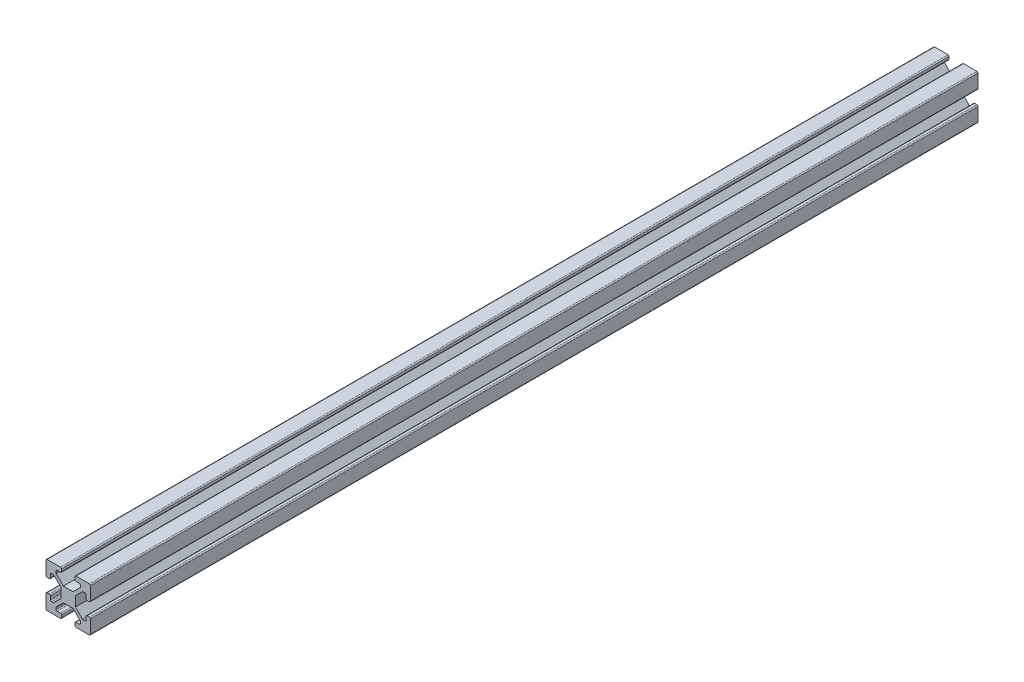
from build123d import *

# Parameters (mm, degrees)
EXTRUDE_1_DEPTH = 400


with BuildPart() as part:
    # 草图1 → 凸台-拉伸1 (new body)
    with BuildSketch(Plane.XY):
        with BuildLine():
            Line((6.5, 0), (0.5, 0))
            ThreePointArc((0.5, 0), (0.146446609, -0.146446609), (0, -0.5))
            Line((0, -0.5), (0, -6.5))
            ThreePointArc((0, -6.5), (0.146446609, -6.853553391), (0.5, -7))
            Line((0.5, -7), (1.5, -7))
            ThreePointArc((1.5, -7), (1.853553391, -6.853553391), (2, -6.5))
            Line((2, -6.5), (2, -5))
            ThreePointArc((2, -5), (2.146446609, -4.646446609), (2.5, -4.5))
            Line((2.5, -4.5), (3.220918534, -4.5))
            ThreePointArc((3.220918534, -4.5), (3.412260251, -4.538060234), (3.574471925, -4.646446609))
            Line((3.574471925, -4.646446609), (6.741642787, -7.813617472))
            Line((6.741642787, -7.813617472), (6.741642787, -12.186382528))
            Line((6.741642787, -12.186382528), (3.574471925, -15.353553391))
            ThreePointArc((3.574471925, -15.353553391), (3.412260251, -15.461939766), (3.220918534, -15.5))
            Line((3.220918534, -15.5), (2.5, -15.5))
            ThreePointArc((2.5, -15.5), (2.146446609, -15.353553391), (2, -15))
            Line((2, -15), (2, -13.5))
            ThreePointArc((2, -13.5), (1.853553391, -13.146446609), (1.5, -13))
            Line((1.5, -13), (0.5, -13))
            ThreePointArc((0.5, -13), (0.146446609, -13.146446609), (0, -13.5))
            Line((0, -13.5), (0, -19.5))
            ThreePointArc((0, -19.5), (0.146446609, -19.853553391), (0.5, -20))
            Line((0.5, -20), (6.5, -20))
            ThreePointArc((6.5, -20), (6.853553391, -19.853553391), (7, -19.5))
            Line((7, -19.5), (7, -18.5))
            ThreePointArc((7, -18.5), (6.853553391, -18.146446609), (6.5, -18))
            Line((6.5, -18), (5, -18))
            ThreePointArc((5, -18), (4.646446609, -17.853553391), (4.5, -17.5))
            Line((4.5, -17.5), (4.5, -16.779081466))
            ThreePointArc((4.5, -16.779081466), (4.538060234, -16.587739749), (4.646446609, -16.425528075))
            Line((4.646446609, -16.425528075), (7.667170862, -13.404803822))
            ThreePointArc((7.667170862, -13.404803822), (7.829382537, -13.296417446), (8.020724253, -13.258357213))
            Line((8.020724253, -13.258357213), (11.979275747, -13.258357213))
            ThreePointArc((11.979275747, -13.258357213), (12.170617463, -13.296417446), (12.332829138, -13.404803822))
            Line((12.332829138, -13.404803822), (15.353553391, -16.425528075))
            ThreePointArc((15.353553391, -16.425528075), (15.461939766, -16.587739749), (15.5, -16.779081466))
            Line((15.5, -16.779081466), (15.5, -17.5))
            ThreePointArc((15.5, -17.5), (15.353553391, -17.853553391), (15, -18))
            Line((15, -18), (13.5, -18))
            ThreePointArc((13.5, -18), (13.146446609, -18.146446609), (13, -18.5))
            Line((13, -18.5), (13, -19.5))
            ThreePointArc((13, -19.5), (13.146446609, -19.853553391), (13.5, -20))
            Line((13.5, -20), (19.5, -20))
            ThreePointArc((19.5, -20), (19.853553391, -19.853553391), (20, -19.5))
            Line((20, -19.5), (20, -13.5))
            ThreePointArc((20, -13.5), (19.853553391, -13.146446609), (19.5, -13))
            Line((19.5, -13), (18.5, -13))
            ThreePointArc((18.5, -13), (18.146446609, -13.146446609), (18, -13.5))
            Line((18, -13.5), (18, -15))
            ThreePointArc((18, -15), (17.853553391, -15.353553391), (17.5, -15.5))
            Line((17.5, -15.5), (16.779081466, -15.5))
            ThreePointArc((16.779081466, -15.5), (16.587739749, -15.461939766), (16.425528075, -15.353553391))
            Line((16.425528075, -15.353553391), (13.258357213, -12.186382528))
            Line((13.258357213, -12.186382528), (13.258357213, -7.813617472))
            Line((13.258357213, -7.813617472), (16.425528075, -4.646446609))
            ThreePointArc((16.425528075, -4.646446609), (16.587739749, -4.538060234), (16.779081466, -4.5))
            Line((16.779081466, -4.5), (17.5, -4.5))
            ThreePointArc((17.5, -4.5), (17.853553391, -4.646446609), (18, -5))
            Line((18, -5), (18, -6.5))
            ThreePointArc((18, -6.5), (18.146446609, -6.853553391), (18.5, -7))
            Line((18.5, -7), (19.5, -7))
            ThreePointArc((19.5, -7), (19.853553391, -6.853553391), (20, -6.5))
            Line((20, -6.5), (20, -0.5))
            ThreePointArc((20, -0.5), (19.853553391, -0.146446609), (19.5, 0))
            Line((19.5, 0), (13.5, 0))
            ThreePointArc((13.5, 0), (13.146446609, -0.146446609), (13, -0.5))
            Line((13, -0.5), (13, -1.5))
            ThreePointArc((13, -1.5), (13.146446609, -1.853553391), (13.5, -2))
            Line((13.5, -2), (15, -2))
            ThreePointArc((15, -2), (15.353553391, -2.146446609), (15.5, -2.5))
            Line((15.5, -2.5), (15.5, -3.220918534))
            ThreePointArc((15.5, -3.220918534), (15.461939766, -3.412260251), (15.353553391, -3.574471925))
            Line((15.353553391, -3.574471925), (12.186382528, -6.741642787))
            Line((12.186382528, -6.741642787), (7.813617472, -6.741642787))
            Line((7.813617472, -6.741642787), (4.646446609, -3.574471925))
            ThreePointArc((4.646446609, -3.574471925), (4.538060234, -3.412260251), (4.5, -3.220918534))
            Line((4.5, -3.220918534), (4.5, -2.5))
            ThreePointArc((4.5, -2.5), (4.646446609, -2.146446609), (5, -2))
            Line((5, -2), (6.5, -2))
            ThreePointArc((6.5, -2), (6.853553391, -1.853553391), (7, -1.5))
            Line((7, -1.5), (7, -0.5))
            ThreePointArc((7, -0.5), (6.853553391, -0.146446609), (6.5, 0))
        make_face()
    extrude(amount=EXTRUDE_1_DEPTH)


solid = part.part
